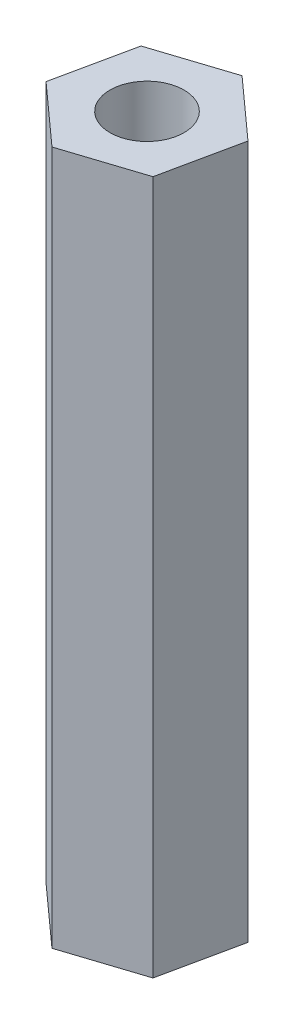
from build123d import *

# Parameters (mm, degrees)
SKETCH1_R           = 1.6
BOSS_EXTRUDE1_DEPTH = 30


with BuildPart() as part:
    # Sketch1 → Boss-Extrude1 (new body)
    with BuildSketch(Plane(origin=(0, 0, 0), x_dir=(1, 0, 0), z_dir=(0, 1, 0))):
        Polygon((2.574846453, -2.317361807), (3.294317421, 1.071201535), (0.719470969, 3.388563342), (-2.574846453, 2.317361807), (-3.294317421, -1.071201535), (-0.719470969, -3.388563342), align=None)
        with Locations(Location((0, 0, 0), (0, 0, 270))):
            Circle(SKETCH1_R, mode=Mode.SUBTRACT)
    extrude(amount=BOSS_EXTRUDE1_DEPTH)


solid = part.part
